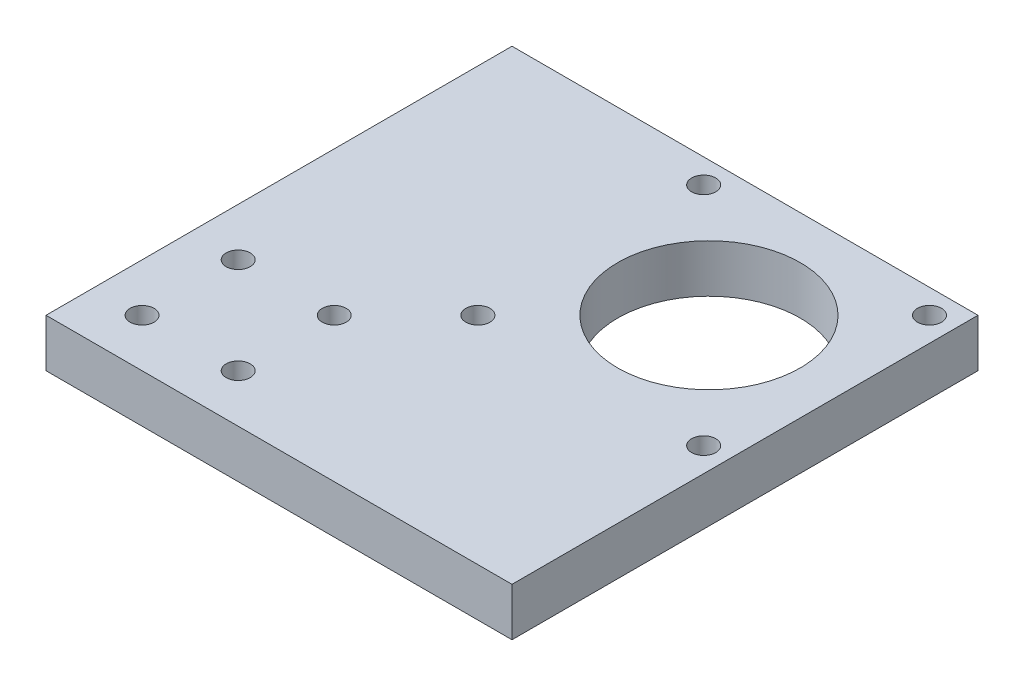
from build123d import *

# Parameters (mm, degrees)
SKETCH1_W           = 97
SKETCH1_H           = 97
BOSS_EXTRUDE1_DEPTH = 10
SKETCH2_R           = 19
SKETCH2_R_2         = 2.51
SKETCH2_R_3         = 2.5
CUT_EXTRUDE1_DEPTH  = 10


with BuildPart() as part:
    # Sketch1 → Boss-Extrude1 (new body)
    with BuildSketch(Plane(origin=(0, 0, 0), x_dir=(1, 0, 0), z_dir=(0, 1, 0))):
        with Locations((48.5, 48.5)):
            Rectangle(SKETCH1_W, SKETCH1_H)
    extrude(amount=BOSS_EXTRUDE1_DEPTH)

    # Sketch2 → Cut-Extrude1 (cut)
    with BuildSketch(Plane(origin=(0, 10, 0), x_dir=(1, 0, 0), z_dir=(0, 1, 0))):
        with Locations(Location((69, 69, 0), (0, 0, 270))):
            Circle(SKETCH2_R)
        with Locations(Location((44.95, 91.95, 0), (0, 0, 270))):
            Circle(SKETCH2_R_2)
        with Locations(Location((91.95, 91.95, 0), (0, 0, 270))):
            Circle(SKETCH2_R_2)
        with Locations(Location((91.95, 44.95, 0), (0, 0, 270))):
            Circle(SKETCH2_R_2)
        with Locations(Location((44.95, 44.95, 0), (0, 0, 270))):
            Circle(SKETCH2_R_2)
        with Locations(Location((10, 10, 0), (0, 0, 270))):
            Circle(SKETCH2_R_3)
        with Locations(Location((30, 10, 0), (0, 0, 270))):
            Circle(SKETCH2_R_3)
        with Locations(Location((30, 30, 0), (0, 0, 270))):
            Circle(SKETCH2_R_3)
        with Locations(Location((10, 30, 0), (0, 0, 270))):
            Circle(SKETCH2_R_3)
    extrude(amount=-CUT_EXTRUDE1_DEPTH, mode=Mode.SUBTRACT)


solid = part.part
